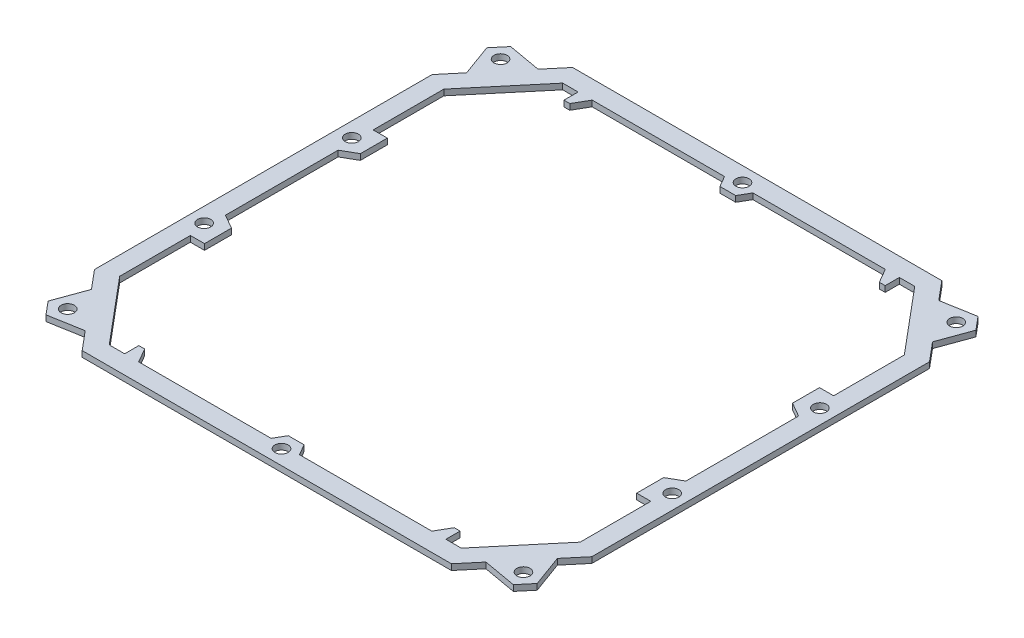
from build123d import *

# Parameters (mm, degrees)
BOSS_EXTRUDE1_DEPTH     = 1.5875
F_1_4_CLEARANCE_HOLE1_D = 7.14248


with BuildPart() as part:
    # Sketch1 → Boss-Extrude1 (new, symmetric)
    with BuildSketch(Plane(origin=(0, 0, 0), x_dir=(1, 0, 0), z_dir=(0, 1, 0))):
        Polygon((-108.508102479, 122.649104887), (-99.990490133, 132.8), (99.990490133, 132.8), (108.508102479, 122.649104887), (126.560486405, 125.832227239), (132.451914797, 118.811096288), (126.182387654, 101.585712032), (134.7, 91.434816919), (134.7, -91.434816919), (126.182387654, -101.585712032), (132.451914797, -118.811096288), (126.560486405, -125.832227239), (108.508102479, -122.649104887), (99.990490133, -132.8), (-99.990490133, -132.8), (-108.508102479, -122.649104887), (-126.560486405, -125.832227239), (-132.451914797, -118.811096288), (-126.182387654, -101.585712032), (-134.7, -91.434816919), (-134.7, 91.434816919), (-126.182387654, 101.585712032), (-132.451914797, 118.811096288), (-126.560486405, 125.832227239), align=None)
        Polygon((-95.327413552, 122.8), (-124.7, 87.795114576), (-124.7, 49.5), (-117.031174581, 49.5), (-117.031174581, 34.92759842), (-124.7, 30.5), (-124.7, -30.5), (-117.031174581, -34.92759842), (-117.031174581, -49.5), (-124.7, -49.5), (-124.7, -87.795114576), (-95.327413552, -122.8), (-87, -122.8), (-87, -115.131174581), (-83.825, -115.131174581), (-79.39740158, -122.8), (-7.681406121, -122.8), (-4.274808593, -116.8996), (4.274808593, -116.8996), (7.681406121, -122.8), (79.39740158, -122.8), (83.825, -115.131174581), (87, -115.131174581), (87, -122.8), (95.327413552, -122.8), (124.7, -87.795114576), (124.7, -49.5), (117.031174581, -49.5), (117.031174581, -34.92759842), (124.7, -30.5), (124.7, 30.5), (117.031174581, 34.92759842), (117.031174581, 49.5), (124.7, 49.5), (124.7, 87.795114576), (95.327413552, 122.8), (87, 122.8), (87, 115.131174581), (83.825, 115.131174581), (79.39740158, 122.8), (7.681406121, 122.8), (4.274808593, 116.8996), (-4.274808593, 116.8996), (-7.681406121, 122.8), (-79.39740158, 122.8), (-83.825, 115.131174581), (-87, 115.131174581), (-87, 122.8), align=None, mode=Mode.SUBTRACT)
    extrude(amount=BOSS_EXTRUDE1_DEPTH, both=True)

    # 1/4 Clearance Hole1 (through all)
    with Locations(Plane(origin=(0, -1.5875, 0), x_dir=(-1, 0, 0), z_dir=(0, -1, 0))):
        with Locations((-123.415994069, 117.211371709), (-126.7498, 40), (0, 124.8498), (123.415994069, 117.211371709), (126.7498, 40), (126.7498, -40), (123.415994069, -117.211371709), (0, -124.8498), (-123.415994069, -117.211371709), (-126.7498, -40)):
            Hole(F_1_4_CLEARANCE_HOLE1_D / 2)


solid = part.part
